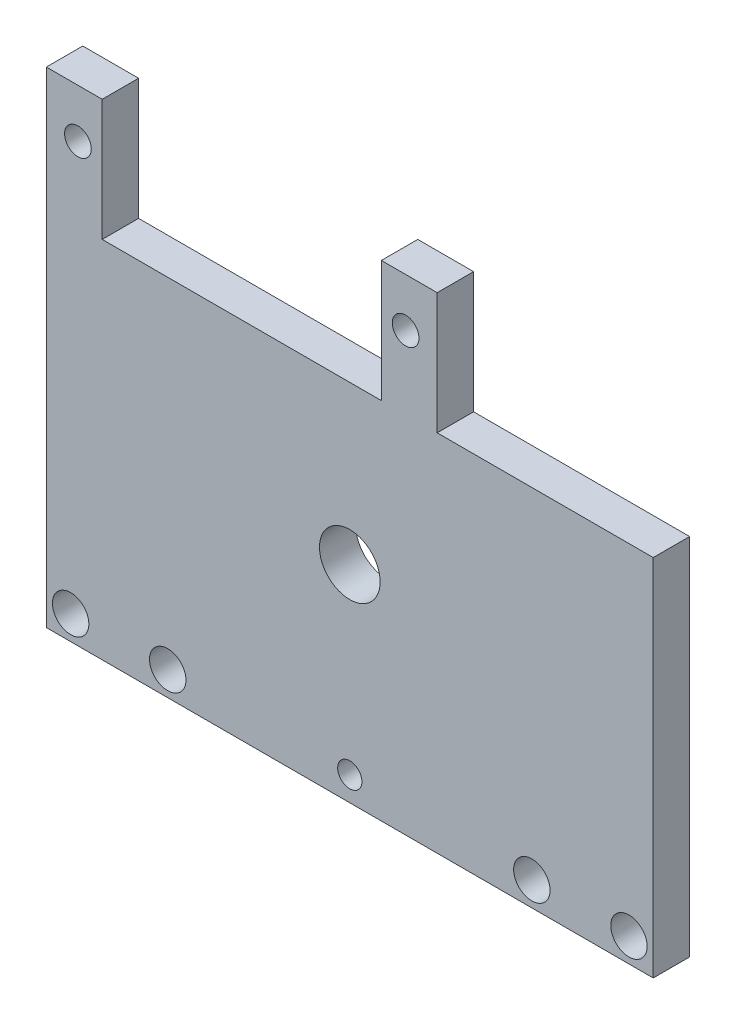
from build123d import *

# Parameters (mm, degrees)
SKETCH_1_R      = 2.5
SKETCH_1_R_2    = 1.1
SKETCH_1_R_3    = 1.5
SKETCH_1_R_4    = 1
EXTRUDE_1_DEPTH = 3


with BuildPart() as part:
    # Эскиз1 → Бобышка-Вытянуть1 (new body)
    with BuildSketch(Plane.XY):
        Polygon((-37.410287044, -22.648677976), (12.589712956, -22.648677976), (12.589712956, 7.351322024), (-5.210287044, 7.351322024), (-5.210287044, 17.351322024), (-9.810287044, 17.351322024), (-9.810287044, 7.351322024), (-32.810287044, 7.351322024), (-32.810287044, 17.351322024), (-37.410287044, 17.351322024), (-37.410287044, 7.351322024), align=None)
        with Locations((-12.410287044, -5.648677976)):
            Circle(SKETCH_1_R, mode=Mode.SUBTRACT)
        with Locations((-34.810287044, 13.351322024)):
            Circle(SKETCH_1_R_2, mode=Mode.SUBTRACT)
        with Locations((-7.810287044, 13.351322024)):
            Circle(SKETCH_1_R_2, mode=Mode.SUBTRACT)
        with Locations((-35.410287044, -20.648677976)):
            Circle(SKETCH_1_R_3, mode=Mode.SUBTRACT)
        with Locations((10.589712956, -20.648677976)):
            Circle(SKETCH_1_R_3, mode=Mode.SUBTRACT)
        with Locations((-12.410287044, -20.648677976)):
            Circle(SKETCH_1_R_4, mode=Mode.SUBTRACT)
        with Locations((-27.410287044, -20.648677976)):
            Circle(SKETCH_1_R_3, mode=Mode.SUBTRACT)
        with Locations((2.589712956, -20.648677976)):
            Circle(SKETCH_1_R_3, mode=Mode.SUBTRACT)
    extrude(amount=EXTRUDE_1_DEPTH)


solid = part.part
